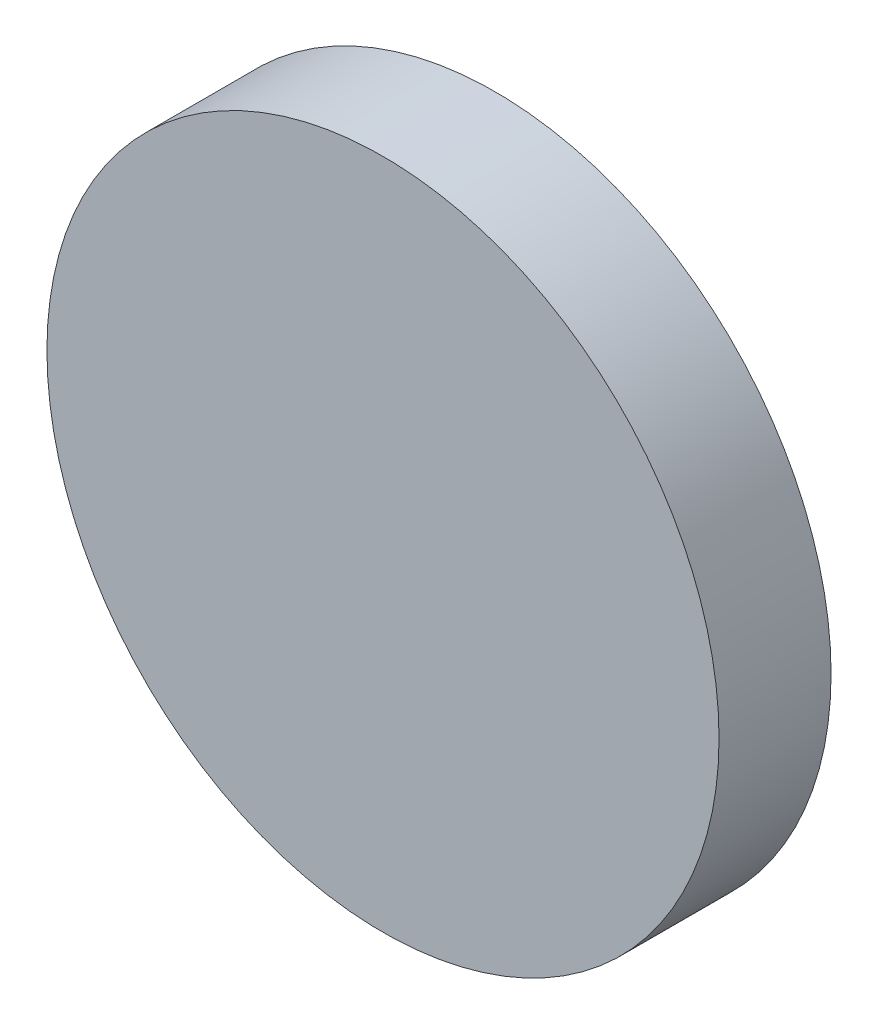
from build123d import *

# Parameters (mm, degrees)
SKETCH1_R           = 19.05
BOSS_EXTRUDE1_DEPTH = 6.35


with BuildPart() as part:
    # Sketch1 → Boss-Extrude1 (new body)
    with BuildSketch(Plane.XY):
        Circle(SKETCH1_R)
    extrude(amount=BOSS_EXTRUDE1_DEPTH)


solid = part.part
